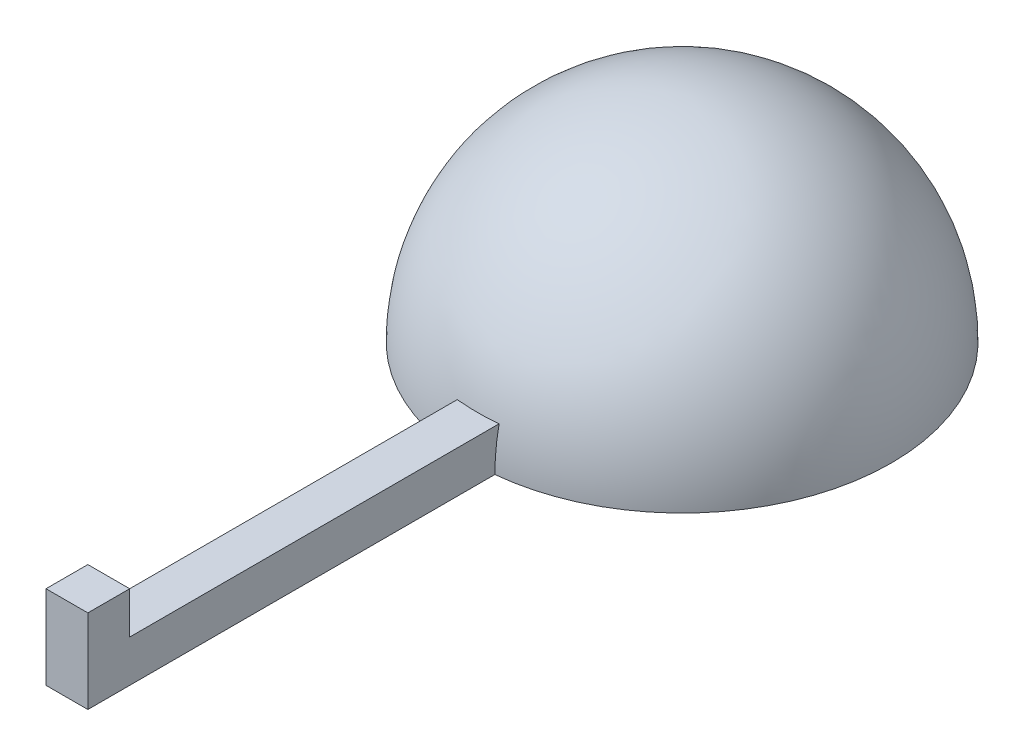
from build123d import *

# Parameters (mm, degrees)
REVOLVE1_ANGLE      = 180
SHELL3_T            = -3
BOSS_EXTRUDE1_DEPTH = 5


with BuildPart() as part:
    # Sketch1 → Revolve1 (revolve)
    with BuildSketch(Plane(origin=(0, 0, 0), x_dir=(1, 0, 0), z_dir=(0, 1, 0))):
        with BuildLine():
            Line((-50, 0), (50, 0))
            ThreePointArc((50, 0), (0, 50), (-50, 0))
        make_face()
    revolve(axis=Axis((-50, 0, 0), (1, 0, 0)), revolution_arc=REVOLVE1_ANGLE)

    # Shell3
    shell3_openings = [part.faces().sort_by_distance(p)[0] for p in [
        (0, 0, 0),
    ]]
    offset(amount=SHELL3_T, openings=shell3_openings)

    # Sketch5 → Boss-Extrude1 (add, symmetric)
    with BuildSketch(Plane(origin=(0, 0, 0), x_dir=(0, 0, -1), z_dir=(1, 0, 0))):
        Polygon((-47, 0), (-47, 10), (-137, 10), (-137, 20), (-147, 20), (-147, 0), align=None)
    extrude(amount=BOSS_EXTRUDE1_DEPTH, both=True)


solid = part.part
